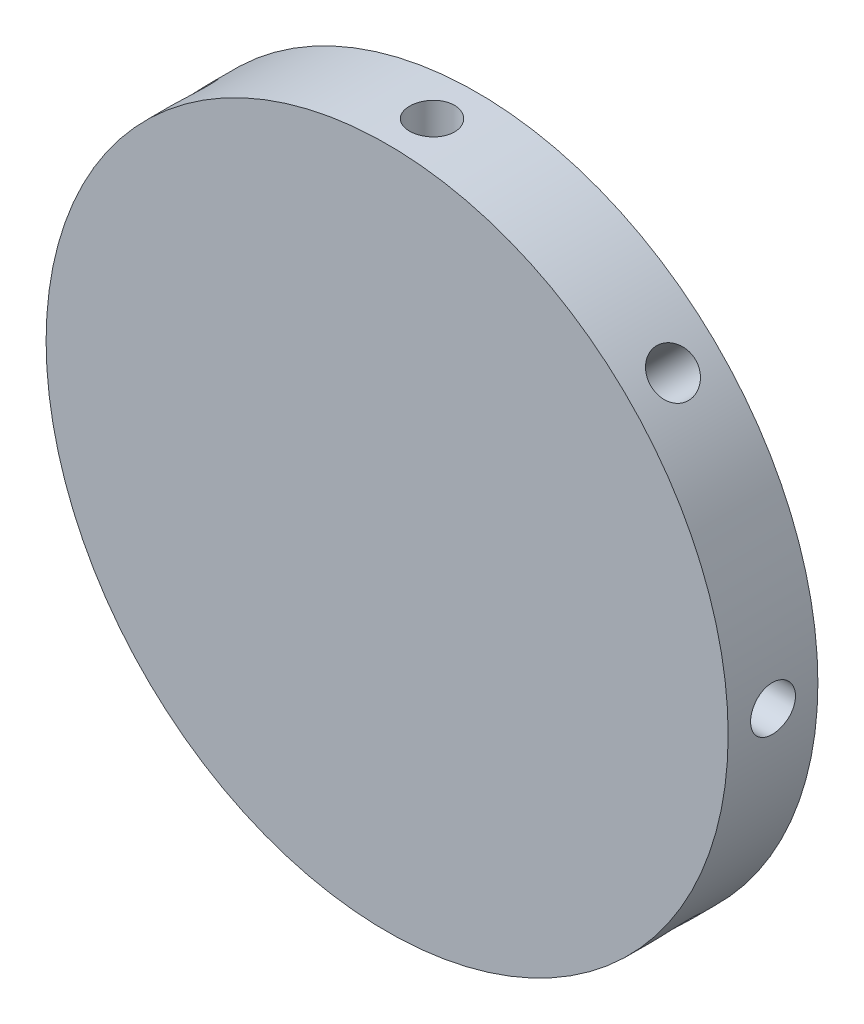
from build123d import *

# Parameters (mm, degrees)
SKETCH1_R           = 38
BOSS_EXTRUDE1_DEPTH = 10
SKETCH2_R           = 2.5
CUT_EXTRUDE1_DEPTH  = 10
CIRPATTERN1_COUNT   = 8


with BuildPart() as part:
    # Sketch1 → Boss-Extrude1 (new body)
    with BuildSketch(Plane.XY):
        Circle(SKETCH1_R)
    extrude(amount=BOSS_EXTRUDE1_DEPTH)

    # Sketch2 → Cut-Extrude1 (cut)
    with BuildSketch(Plane(origin=(0, 38, 0), x_dir=(1, 0, 0), z_dir=(0, 1, 0))):
        with Locations(Location((0, -5, 0), (0, 0, 270))):
            Circle(SKETCH2_R)
    cut_extrude1 = extrude(amount=-CUT_EXTRUDE1_DEPTH, mode=Mode.SUBTRACT)

    # CirPattern1: Cut-Extrude1 ×8 about axis
    cirpattern1_axis = Axis((0, 0, 0), (0, 0, 1))
    for i in range(1, CIRPATTERN1_COUNT):
        add(cut_extrude1.rotate(cirpattern1_axis, i * 360 / CIRPATTERN1_COUNT), mode=Mode.SUBTRACT)


solid = part.part
